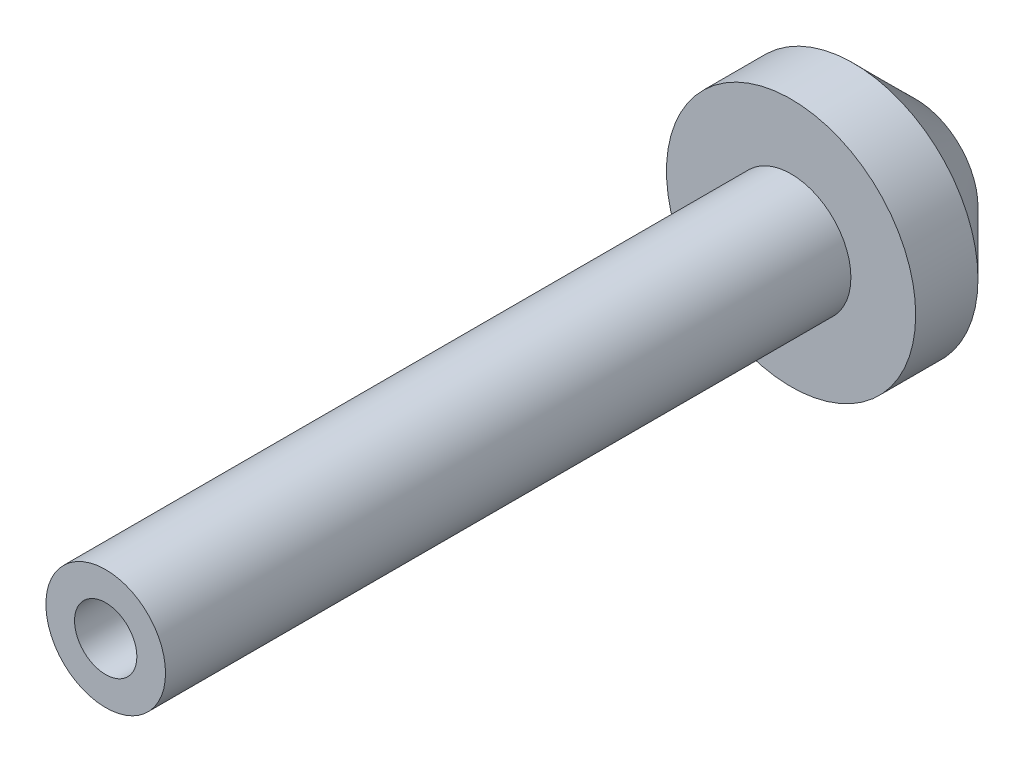
from build123d import *

# Parameters (mm, degrees)
SKETCH1_R           = 5
BOSS_EXTRUDE1_DEPTH = 5
SKETCH2_R           = 2.4
BOSS_EXTRUDE2_DEPTH = 27.5
CHAMFER1_SIZE       = 2.5
SKETCH3_R           = 1.25
CUT_EXTRUDE1_DEPTH  = 34.260336739


with BuildPart() as part:
    # Sketch1 → Boss-Extrude1 (new body)
    with BuildSketch(Plane.XY):
        Circle(SKETCH1_R)
    extrude(amount=BOSS_EXTRUDE1_DEPTH)

    # Sketch2 → Boss-Extrude2 (add)
    with BuildSketch(Plane.XY.offset(5)):
        Circle(SKETCH2_R)
    extrude(amount=BOSS_EXTRUDE2_DEPTH)

    # Chamfer1
    chamfer1_edges = [part.edges().sort_by_distance(p)[0] for p in [
        (-5, 0, 0),
    ]]
    chamfer(chamfer1_edges, length=CHAMFER1_SIZE)

    # Sketch3 → Cut-Extrude1 (cut, through all)
    with BuildSketch(Plane.XY.offset(32.5)):
        Circle(SKETCH3_R)
    extrude(amount=-CUT_EXTRUDE1_DEPTH, mode=Mode.SUBTRACT)


solid = part.part
